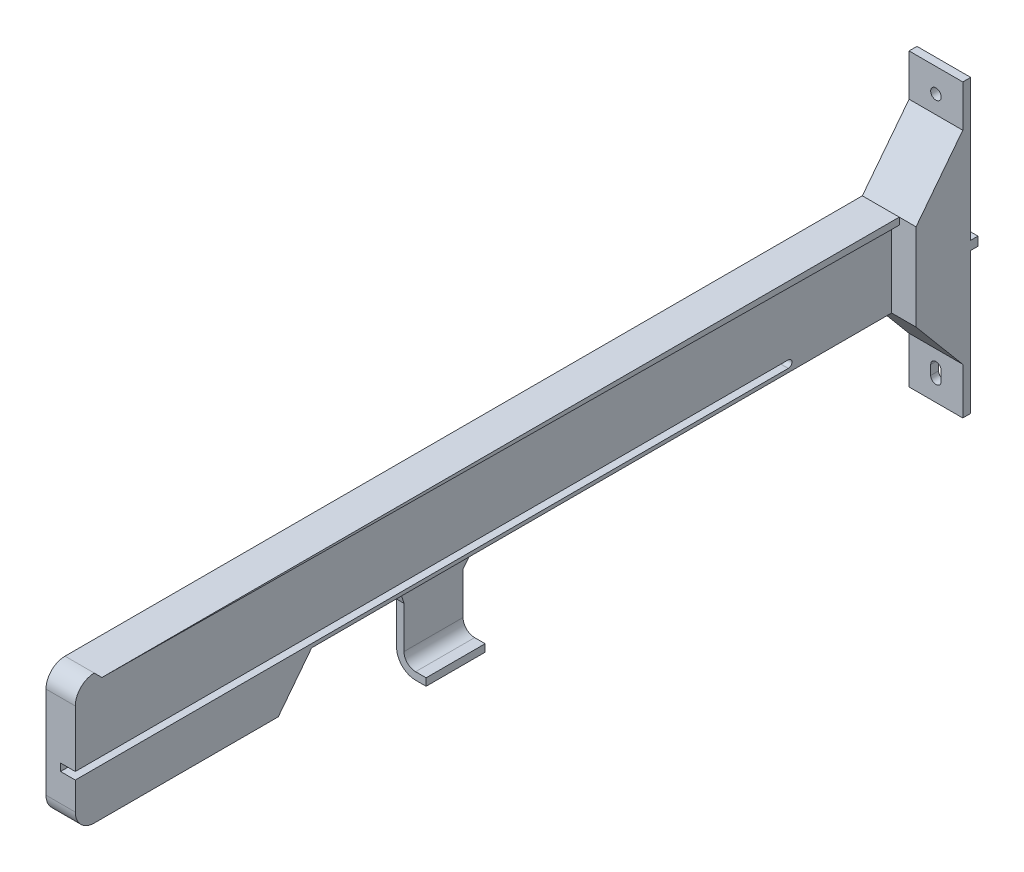
from build123d import *

# Parameters (mm, degrees)
BOSS_EXTRUDE1_DEPTH  = 12.6
BOSS_EXTRUDE2_DEPTH  = 23.1
BOSS_EXTRUDE3_DEPTH  = 3.175
SKETCH1_5_W          = 25.4
SKETCH1_5_H          = 3.175
BOSS_EXTRUDE4_DEPTH  = 12.7
FILLET1_R            = 5
FILLET2_R            = 8.175
CUT_EXTRUDE1_DEPTH   = 6.35
CUT_EXTRUDE2_REACH   = 386.06
SKETCH3_R            = 2.275
SKETCH4_W            = 23.1
SKETCH4_H            = 3.8
SKETCH4_W_2          = 3.8
SKETCH4_H_2          = 76.45
EXTRUDE_THIN1_DEPTH  = 3.15
SKETCH5_R            = 2.875
BOSS_EXTRUDE5_DEPTH  = 6.2
BOSS_EXTRUDE5_TAPER  = 2
FILLET1_OF_MIRROR1_R = 5
FILLET2_OF_MIRROR1_R = 8.175
SKETCH6_R            = 2.875
BOSS_EXTRUDE6_DEPTH  = 6.2
BOSS_EXTRUDE7_DEPTH  = 3.28


with BuildPart() as part:
    # Sketch1 → Boss-Extrude1 (new body)
    with BuildSketch(Plane(origin=(0, 0, 0), x_dir=(0, 0, -1), z_dir=(1, 0, 0))):
        Polygon((175.575, -37.35), (175.575, 0), (-175.575, 0), (-175.575, -55.88), (-88.271480231, -55.88), (-73.904922854, -37.35), (-28.686383268, -37.35), (10.475, -37.35), align=None)
    boss_extrude1 = extrude(amount=-BOSS_EXTRUDE1_DEPTH)

    # Sketch1<3> → Boss-Extrude2 (add)
    with BuildSketch(Plane(origin=(0, 0, 0), x_dir=(0, 0, -1), z_dir=(1, 0, 0))):
        Polygon((175.575, 0), (195.675, 25.925), (195.675, 43.925), (199.075, 43.925), (199.075, -81.275), (195.675, -81.275), (195.675, -61.275), (175.575, -37.35), align=None)
    boss_extrude2 = extrude(amount=-BOSS_EXTRUDE2_DEPTH)

    # Sketch1<4> → Boss-Extrude3 (add)
    with BuildSketch(Plane(origin=(0, 0, 0), x_dir=(0, 0, -1), z_dir=(1, 0, 0))):
        Polygon((0.628519769, -50.05), (10.475, -37.35), (-28.686383268, -37.35), (-24.771480231, -50.05), (-24.771480231, -73.025), (0.628519769, -73.025), align=None)
    boss_extrude3 = extrude(amount=-BOSS_EXTRUDE3_DEPTH)

    # Sketch1<5> → Boss-Extrude4 (add)
    with BuildSketch(Plane(origin=(0, 0, 0), x_dir=(0, 0, -1), z_dir=(1, 0, 0))):
        with Locations((-12.071480231, -74.6125)):
            Rectangle(SKETCH1_5_W, SKETCH1_5_H)
    boss_extrude4 = extrude(amount=-BOSS_EXTRUDE4_DEPTH)

    # Fillet1
    fillet1_edges = [part.edges().sort_by_distance(p)[0] for p in [
        (-3.175, -73.025, 12.071480231),
    ]]
    fillet(fillet1_edges, radius=FILLET1_R)

    # Fillet2
    fillet2_edges = [part.edges().sort_by_distance(p)[0] for p in [
        (-6.3, -55.88, 175.575),
        (-6.3, 0, 175.575),
        (0, -76.2, 12.071480231),
    ]]
    fillet(fillet2_edges, radius=FILLET2_R)

    # Sketch2 → Cut-Extrude1 (cut)
    with BuildSketch(Plane.ZY.offset(12.6)):
        with BuildLine():
            Line((-131.125, -32.5875), (222.402046917, -32.5875))
            ThreePointArc((222.402046917, -32.5875), (223.989546917, -34.175), (222.402046917, -35.7625))
            Line((222.402046917, -35.7625), (-131.125, -35.7625))
            ThreePointArc((-131.125, -35.7625), (-132.7125, -34.175), (-131.125, -32.5875))
        make_face()
    cut_extrude1 = extrude(amount=-CUT_EXTRUDE1_DEPTH, mode=Mode.SUBTRACT)

    # Sketch3 → Cut-Extrude2 (cut, up to next)
    with BuildSketch(Plane(origin=(0, 0, -199.075), x_dir=(-1, 0, 0), z_dir=(0, 0, -1)), mode=Mode.PRIVATE) as cut_extrude2_sk1:
        with Locations((11.55, 33.65)):
            Circle(SKETCH3_R)
    cut_extrude2_tool1 = extrude(cut_extrude2_sk1.sketch, amount=-CUT_EXTRUDE2_REACH, mode=Mode.PRIVATE) & part.part
    # Sketch3 → Cut-Extrude2 (cut, up to next)
    with BuildSketch(Plane(origin=(0, 0, -199.075), x_dir=(-1, 0, 0), z_dir=(0, 0, -1)), mode=Mode.PRIVATE) as cut_extrude2_sk2:
        with BuildLine():
            Line((9.3, -72.325), (9.3, -68.275))
            ThreePointArc((9.3, -68.275), (11.55, -66.025), (13.8, -68.275))
            Line((13.8, -68.275), (13.8, -72.325))
            ThreePointArc((13.8, -72.325), (11.55, -74.575), (9.3, -72.325))
        make_face()
    cut_extrude2_tool2 = extrude(cut_extrude2_sk2.sketch, amount=-CUT_EXTRUDE2_REACH, mode=Mode.PRIVATE) & part.part
    cut_extrude2_1 = cut_extrude2_tool1.solids().sort_by_distance((-11.55, 33.65, -199.075))[0]
    add(cut_extrude2_1, mode=Mode.SUBTRACT)
    cut_extrude2_2 = cut_extrude2_tool2.solids().sort_by_distance((-11.55, -70.3, -199.075))[0]
    add(cut_extrude2_2, mode=Mode.SUBTRACT)
    cut_extrude2 = cut_extrude2_1 + cut_extrude2_2  # Cut-Extrude2 as one shape, for the pattern or mirror that repeats it

    # Sketch4 → Extrude-Thin1 (add)
    with BuildSketch(Plane(origin=(0, 0, -199.075), x_dir=(-1, 0, 0), z_dir=(0, 0, -1))):
        with Locations((11.55, -18.675)):
            Rectangle(SKETCH4_W, SKETCH4_H)
        with Locations((11.55, -18.675)):
            Rectangle(SKETCH4_W_2, SKETCH4_H_2)
    extrude_thin1 = extrude(amount=EXTRUDE_THIN1_DEPTH)

    # Sketch5 → Boss-Extrude5 (add)
    with BuildSketch(Plane(origin=(0, 0, 0), x_dir=(0, 0, -1), z_dir=(1, 0, 0))):
        with Locations((-106.425, -48.98)):
            Circle(SKETCH5_R)
    extrude(amount=BOSS_EXTRUDE5_DEPTH, taper=BOSS_EXTRUDE5_TAPER)


with BuildPart() as mirror1_1:
    # Mirror1: Boss-Extrude1, Boss-Extrude2, Boss-Extrude3, Boss-Extrude4 across plane
    add(boss_extrude1.mirror(Plane(origin=(0, 0, 0), x_dir=(0, 0, 1), z_dir=(1, 0, 0))))
    add(boss_extrude2.mirror(Plane(origin=(0, 0, 0), x_dir=(0, 0, 1), z_dir=(1, 0, 0))))
    add(boss_extrude3.mirror(Plane(origin=(0, 0, 0), x_dir=(0, 0, 1), z_dir=(1, 0, 0))))
    add(boss_extrude4.mirror(Plane(origin=(0, 0, 0), x_dir=(0, 0, 1), z_dir=(1, 0, 0))))

    # Mirror1 2: Cut-Extrude1, Cut-Extrude2 across plane
    add(cut_extrude1.mirror(Plane(origin=(0, 0, 0), x_dir=(0, 0, 1), z_dir=(1, 0, 0))), mode=Mode.SUBTRACT)
    add(cut_extrude2.mirror(Plane(origin=(0, 0, 0), x_dir=(0, 0, 1), z_dir=(1, 0, 0))), mode=Mode.SUBTRACT)

    # Fillet1 of Mirror1
    fillet1_of_mirror1_edges = [mirror1_1.edges().sort_by_distance(p)[0] for p in [
        (3.175, -73.025, 12.071480231),
    ]]
    fillet(fillet1_of_mirror1_edges, radius=FILLET1_OF_MIRROR1_R)

    # Fillet2 of Mirror1
    fillet2_of_mirror1_edges = [mirror1_1.edges().sort_by_distance(p)[0] for p in [
        (6.3, -55.88, 175.575),
        (6.3, 0, 175.575),
        (0, -76.2, 12.071480231),
    ]]
    fillet(fillet2_of_mirror1_edges, radius=FILLET2_OF_MIRROR1_R)


with BuildPart() as mirror1_3_1:
    # Mirror1 3: Extrude-Thin1 across plane
    add(extrude_thin1.mirror(Plane(origin=(0, 0, 0), x_dir=(0, 0, 1), z_dir=(1, 0, 0))))


with BuildPart() as part_1:
    add(part.part)

    # Mirror1 united with what the copies touc: union Mirror1_1, Mirror1 3_1
    add(mirror1_1.part)
    add(mirror1_3_1.part)

    # SurfaceCut1
    split(bisect_by=Plane(origin=(0, 0, 0), x_dir=(0, 0, -1), z_dir=(1, 0, 0)), keep=Keep.TOP)

    # Sketch6 → Boss-Extrude6 (add)
    with BuildSketch(Plane.ZY):
        with Locations(Location((106.425, -15.125, 0), (0, 0, 180))):
            Circle(SKETCH6_R)
    extrude(amount=BOSS_EXTRUDE6_DEPTH)

    # Sketch7 → Boss-Extrude7 (add)
    with BuildSketch(Plane(origin=(12.6, 0, 0), x_dir=(0, 0, -1), z_dir=(1, 0, 0))):
        Polygon((175.575, 0), (175.575, -3), (-167.4, 0), align=None)
    extrude(amount=BOSS_EXTRUDE7_DEPTH)


solid = part_1.part
